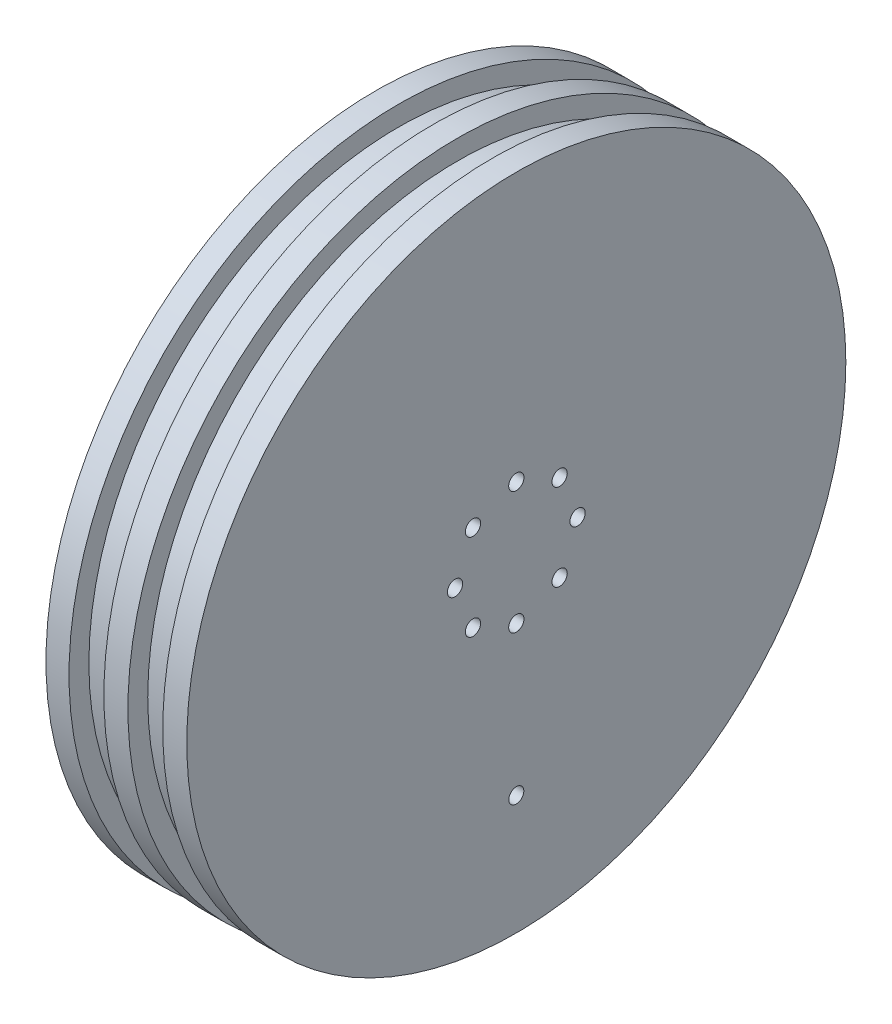
from build123d import *

# Parameters (mm, degrees)
CIRPATTERN2_COUNT              = 3
F_50_0_07_DIAMETER_HOLE1_D     = 1.778
F_50_0_07_DIAMETER_HOLE1_DEPTH = 11.938
F_50_0_07_DIAMETER_HOLE1_TIP   = 0.53416509
SKETCH60_R                     = 4.7625
BOSS_EXTRUDE4_DEPTH            = 5.461
CUT_EXTRUDE1_REACH             = 54.472
SKETCH54_R                     = 0.80645
F_1_16_0_0625_DIAMETER_HOLE1_D = 1.5875
Q_0_332_DIAMETER_HOLE2_D       = 8.4328
Q_0_332_DIAMETER_HOLE2_DEPTH   = 8.89
Q_0_332_DIAMETER_HOLE2_TIP     = 2.533468714


with BuildPart() as part:
    # Sketch1 → Revolve1 (revolve)
    with BuildSketch(Plane.XY, mode=Mode.PRIVATE) as revolve1_sk:
        Polygon((-12.599, 0), (0, 0), (0, 34.8361), (-2.54, 34.8361), (-2.54, 32.7406), (-6.223, 32.7406), (-6.223, 34.8361), (-8.763, 34.8361), (-8.763, 32.7406), (-12.446, 32.7406), (-12.446, 34.8361), (-14.885, 34.8361), (-14.885, 29.1592), (-18.06, 29.1592), (-18.06, 4.7625), (-12.599, 4.7625), align=None)
    revolve(revolve1_sk.sketch.rotate(Axis((17.779879847, 0, 0), (-1, 0, 0)), 90), axis=Axis((17.779879847, 0, 0), (-1, 0, 0)))

    # Sketch24 → #20 (0.161) Diameter Hole1 (revolve, cut)
    with BuildSketch(Plane(origin=(-18.06, 20.6375, 0), x_dir=(0, 0, 1), z_dir=(0, 1, 0))):
        Polygon((0, 0), (0, 10.880579708), (2.0447, 9.652), (2.0447, 0), align=None)
    f_20_0_161_diameter_hole1 = revolve(axis=Axis((-24.41, 20.6375, 0), (1, 0, 0)), mode=Mode.SUBTRACT)

    # CirPattern2: #20 (0.161) Diameter Hole1 ×3 about axis
    cirpattern2_axis = Axis((0, 0, 0), (1, 0, 0))
    for i in range(1, CIRPATTERN2_COUNT):
        add(f_20_0_161_diameter_hole1.rotate(cirpattern2_axis, i * 360 / CIRPATTERN2_COUNT), mode=Mode.SUBTRACT)

    # #50 (0.07) Diameter Hole1
    with Locations(Plane.ZY.offset(18.06)):
        with Locations((17.872599271, 10.31875)):
            Hole(F_50_0_07_DIAMETER_HOLE1_D / 2, depth=F_50_0_07_DIAMETER_HOLE1_DEPTH)
            with Locations((0, 0, -(F_50_0_07_DIAMETER_HOLE1_DEPTH + F_50_0_07_DIAMETER_HOLE1_TIP / 2))):  # 118° drill point
                Cone(0, F_50_0_07_DIAMETER_HOLE1_D / 2, F_50_0_07_DIAMETER_HOLE1_TIP, mode=Mode.SUBTRACT)

    # Sketch60 → Boss-Extrude4 (add)
    with BuildSketch(Plane.ZY.offset(12.599)):
        Circle(SKETCH60_R)
    extrude(amount=BOSS_EXTRUDE4_DEPTH)

    # Sketch54 → Cut-Extrude1 (cut, up to next)
    with BuildSketch(Plane(origin=(0, 0, 0), x_dir=(0, 0, -1), z_dir=(1, 0, 0)), mode=Mode.PRIVATE) as cut_extrude1_sk1:
        with Locations((0, 6.477)):
            Circle(SKETCH54_R)
    cut_extrude1_tool1 = extrude(cut_extrude1_sk1.sketch, amount=-CUT_EXTRUDE1_REACH, mode=Mode.PRIVATE) & part.part
    # Sketch54 → Cut-Extrude1 (cut, up to next)
    with BuildSketch(Plane(origin=(0, 0, 0), x_dir=(0, 0, -1), z_dir=(1, 0, 0)), mode=Mode.PRIVATE) as cut_extrude1_sk2:
        with Locations((4.579930622, 4.579930622)):
            Circle(SKETCH54_R)
    cut_extrude1_tool2 = extrude(cut_extrude1_sk2.sketch, amount=-CUT_EXTRUDE1_REACH, mode=Mode.PRIVATE) & part.part
    # Sketch54 → Cut-Extrude1 (cut, up to next)
    with BuildSketch(Plane(origin=(0, 0, 0), x_dir=(0, 0, -1), z_dir=(1, 0, 0)), mode=Mode.PRIVATE) as cut_extrude1_sk3:
        with Locations((6.477, 0)):
            Circle(SKETCH54_R)
    cut_extrude1_tool3 = extrude(cut_extrude1_sk3.sketch, amount=-CUT_EXTRUDE1_REACH, mode=Mode.PRIVATE) & part.part
    # Sketch54 → Cut-Extrude1 (cut, up to next)
    with BuildSketch(Plane(origin=(0, 0, 0), x_dir=(0, 0, -1), z_dir=(1, 0, 0)), mode=Mode.PRIVATE) as cut_extrude1_sk4:
        with Locations((4.579930622, -4.579930622)):
            Circle(SKETCH54_R)
    cut_extrude1_tool4 = extrude(cut_extrude1_sk4.sketch, amount=-CUT_EXTRUDE1_REACH, mode=Mode.PRIVATE) & part.part
    # Sketch54 → Cut-Extrude1 (cut, up to next)
    with BuildSketch(Plane(origin=(0, 0, 0), x_dir=(0, 0, -1), z_dir=(1, 0, 0)), mode=Mode.PRIVATE) as cut_extrude1_sk5:
        with Locations((0, -6.477)):
            Circle(SKETCH54_R)
    cut_extrude1_tool5 = extrude(cut_extrude1_sk5.sketch, amount=-CUT_EXTRUDE1_REACH, mode=Mode.PRIVATE) & part.part
    # Sketch54 → Cut-Extrude1 (cut, up to next)
    with BuildSketch(Plane(origin=(0, 0, 0), x_dir=(0, 0, -1), z_dir=(1, 0, 0)), mode=Mode.PRIVATE) as cut_extrude1_sk6:
        with Locations((-4.579930622, -4.579930622)):
            Circle(SKETCH54_R)
    cut_extrude1_tool6 = extrude(cut_extrude1_sk6.sketch, amount=-CUT_EXTRUDE1_REACH, mode=Mode.PRIVATE) & part.part
    # Sketch54 → Cut-Extrude1 (cut, up to next)
    with BuildSketch(Plane(origin=(0, 0, 0), x_dir=(0, 0, -1), z_dir=(1, 0, 0)), mode=Mode.PRIVATE) as cut_extrude1_sk7:
        with Locations((-6.477, 0)):
            Circle(SKETCH54_R)
    cut_extrude1_tool7 = extrude(cut_extrude1_sk7.sketch, amount=-CUT_EXTRUDE1_REACH, mode=Mode.PRIVATE) & part.part
    # Sketch54 → Cut-Extrude1 (cut, up to next)
    with BuildSketch(Plane(origin=(0, 0, 0), x_dir=(0, 0, -1), z_dir=(1, 0, 0)), mode=Mode.PRIVATE) as cut_extrude1_sk8:
        with Locations((-4.579930622, 4.579930622)):
            Circle(SKETCH54_R)
    cut_extrude1_tool8 = extrude(cut_extrude1_sk8.sketch, amount=-CUT_EXTRUDE1_REACH, mode=Mode.PRIVATE) & part.part
    add(cut_extrude1_tool1.solids().sort_by_distance((0, 6.477, 0))[0], mode=Mode.SUBTRACT)
    add(cut_extrude1_tool2.solids().sort_by_distance((0, 4.579931, -4.579931))[0], mode=Mode.SUBTRACT)
    add(cut_extrude1_tool3.solids().sort_by_distance((0, 0, -6.477))[0], mode=Mode.SUBTRACT)
    add(cut_extrude1_tool4.solids().sort_by_distance((0, -4.579931, -4.579931))[0], mode=Mode.SUBTRACT)
    add(cut_extrude1_tool5.solids().sort_by_distance((0, -6.477, 0))[0], mode=Mode.SUBTRACT)
    add(cut_extrude1_tool6.solids().sort_by_distance((0, -4.579931, 4.579931))[0], mode=Mode.SUBTRACT)
    add(cut_extrude1_tool7.solids().sort_by_distance((0, 0, 6.477))[0], mode=Mode.SUBTRACT)
    add(cut_extrude1_tool8.solids().sort_by_distance((0, 4.579931, 4.579931))[0], mode=Mode.SUBTRACT)

    # 1/16 (0.0625) Diameter Hole1 (through all)
    with Locations(Plane(origin=(0, -22.225, 0), x_dir=(0, 0, 1), z_dir=(1, 0, 0))):
        with Locations((0, 0)):
            Hole(F_1_16_0_0625_DIAMETER_HOLE1_D / 2)

    # Q (0.332) Diameter Hole2
    with Locations(Plane(origin=(-18.06, -22.225, 0), x_dir=(0, 0, -1), z_dir=(-1, 0, 0))):
        with Locations((0, 0)):
            Hole(Q_0_332_DIAMETER_HOLE2_D / 2, depth=Q_0_332_DIAMETER_HOLE2_DEPTH)
            with Locations((0, 0, -(Q_0_332_DIAMETER_HOLE2_DEPTH + Q_0_332_DIAMETER_HOLE2_TIP / 2))):  # 118° drill point
                Cone(0, Q_0_332_DIAMETER_HOLE2_D / 2, Q_0_332_DIAMETER_HOLE2_TIP, mode=Mode.SUBTRACT)


solid = part.part
